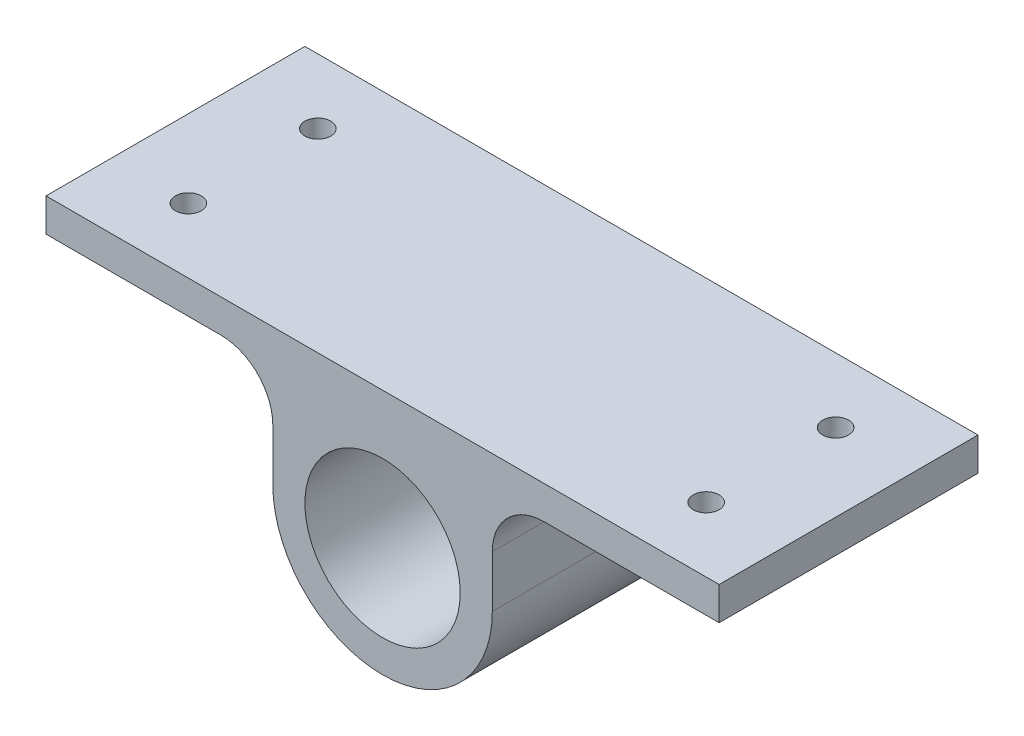
from build123d import *

# Parameters (mm, degrees)
SKETCH1_R           = 75
BOSS_EXTRUDE1_DEPTH = 250
SKETCH2_R           = 12.5
CUT_EXTRUDE1_DEPTH  = 736.964673065


with BuildPart() as part:
    # Sketch1 → Boss-Extrude1 (new body)
    with BuildSketch(Plane.XY):
        with BuildLine():
            Line((0, 0), (650, 0))
            Line((650, 0), (650, -32))
            Line((650, -32), (481, -32))
            ThreePointArc((481, -32), (445.644660941, -46.644660941), (431, -82))
            Line((431, -82), (431, -132))
            ThreePointArc((431, -132), (325, -238), (219, -132))
            Line((219, -132), (219, -82))
            ThreePointArc((219, -82), (204.355339059, -46.644660941), (169, -32))
            Line((169, -32), (0, -32))
            Line((0, -32), (0, 0))
        make_face()
        with Locations((325, -132)):
            Circle(SKETCH1_R, mode=Mode.SUBTRACT)
    extrude(amount=BOSS_EXTRUDE1_DEPTH)

    # Sketch2 → Cut-Extrude1 (cut, through all)
    with BuildSketch(Plane(origin=(0, 0, 0), x_dir=(1, 0, 0), z_dir=(0, 1, 0))):
        with Locations(Location((575, -62.5, 0), (0, 0, 180))):
            Circle(SKETCH2_R)
        with Locations(Location((575, -187.5, 0), (0, 0, 180))):
            Circle(SKETCH2_R)
        with Locations(Location((75, -62.5, 0), (0, 0, 180))):
            Circle(SKETCH2_R)
        with Locations(Location((75, -187.5, 0), (0, 0, 180))):
            Circle(SKETCH2_R)
    extrude(amount=-CUT_EXTRUDE1_DEPTH, mode=Mode.SUBTRACT)


solid = part.part
